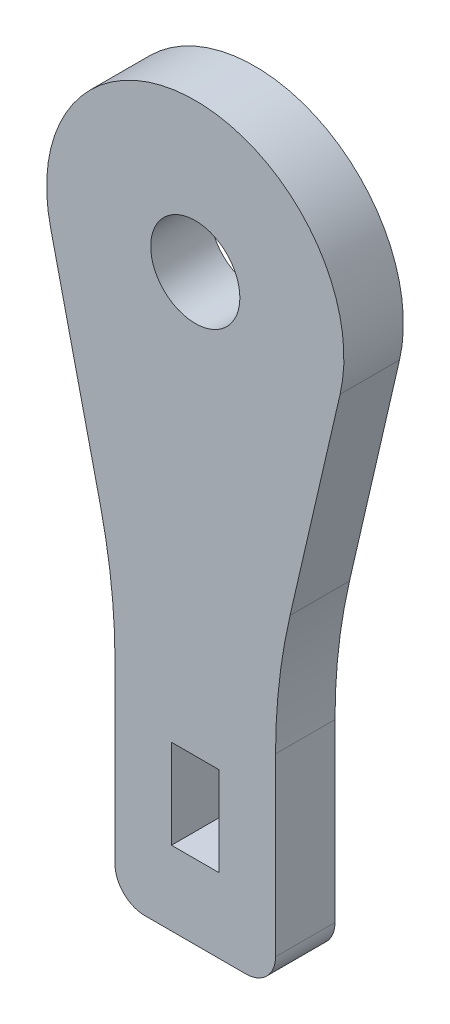
from build123d import *

# Parameters (mm, degrees)
SKETCH1_R           = 7.5
SKETCH1_W           = 8
SKETCH1_H           = 15
BOSS_EXTRUDE1_DEPTH = 10


with BuildPart() as part:
    # Sketch1 → Boss-Extrude1 (new body)
    with BuildSketch(Plane.XY):
        with BuildLine():
            Line((-79.357935679, -5.629473283), (-70.941049916, -42.048149016))
            ThreePointArc((-70.941049916, -42.048149016), (-69.113137448, -52.674804492), (-68.501205497, -63.440147491))
            Line((-68.501205497, -63.440147491), (-68.501205497, -93))
            ThreePointArc((-68.501205497, -93), (-67.036739403, -96.535533906), (-63.501205497, -98))
            Line((-63.501205497, -98), (-46.498794503, -98))
            ThreePointArc((-46.498794503, -98), (-42.963260597, -96.535533906), (-41.498794503, -93))
            Line((-41.498794503, -93), (-41.498794503, -63.440147491))
            ThreePointArc((-41.498794503, -63.440147491), (-40.886862552, -52.674804492), (-39.058950084, -42.048149016))
            Line((-39.058950084, -42.048149016), (-30.642064321, -5.629473283))
            ThreePointArc((-30.642064321, -5.629473283), (-55, 25), (-79.357935679, -5.629473283))
        make_face()
        with Locations((-55, 0)):
            Circle(SKETCH1_R, mode=Mode.SUBTRACT)
        with Locations((-55, -78)):
            Rectangle(SKETCH1_W, SKETCH1_H, mode=Mode.SUBTRACT)
    extrude(amount=BOSS_EXTRUDE1_DEPTH)


solid = part.part
